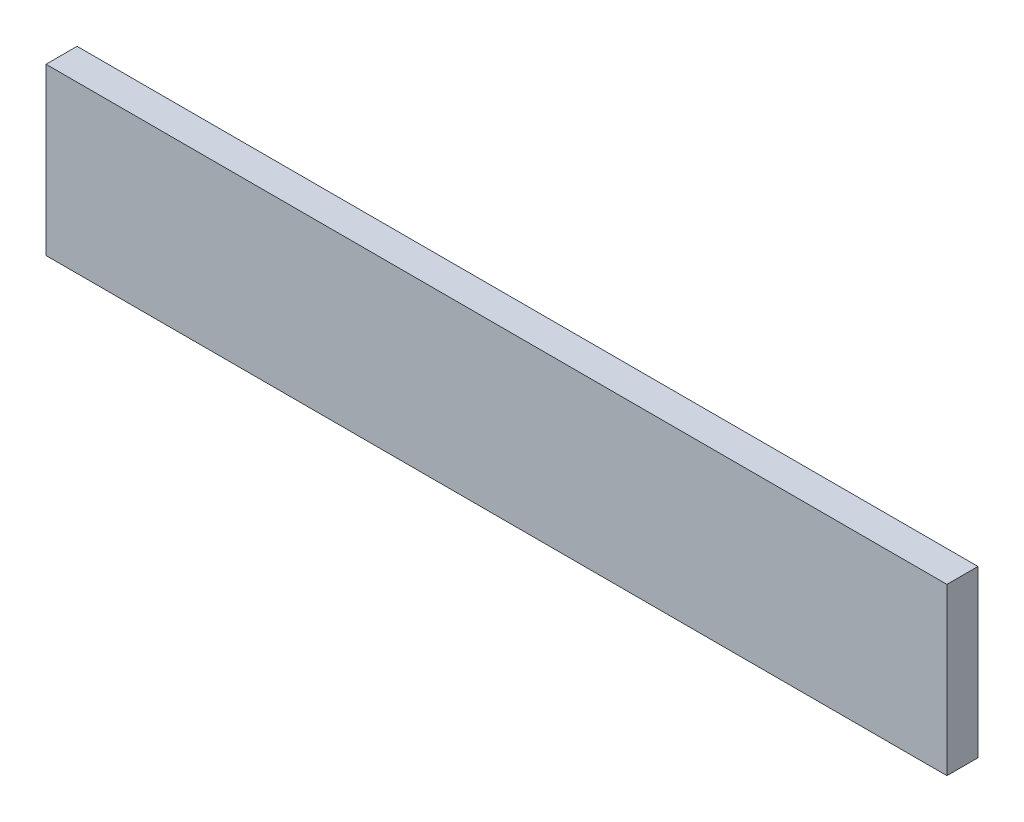
from build123d import *

# Parameters (mm, degrees)
SKETCH1_W           = 43.5
SKETCH1_H           = 1.5
BOSS_EXTRUDE1_DEPTH = 8


with BuildPart() as part:
    # Sketch1 → Boss-Extrude1 (new body)
    with BuildSketch(Plane(origin=(0, 0, 0), x_dir=(1, 0, 0), z_dir=(0, 1, 0))):
        with Locations((21.75, 0.75)):
            Rectangle(SKETCH1_W, SKETCH1_H)
    extrude(amount=BOSS_EXTRUDE1_DEPTH)


solid = part.part
